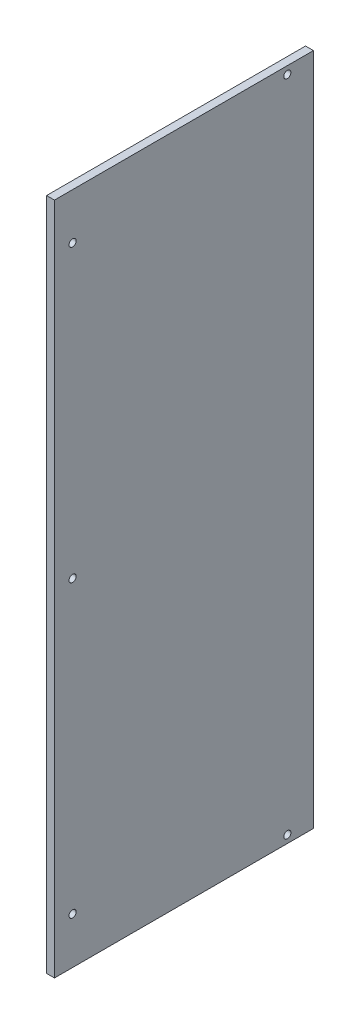
from build123d import *

# Parameters (mm, degrees)
SKETCH1_W             = 156.21
SKETCH1_H             = 406.4
BOSS_EXTRUDE1_DEPTH   = 4.7625
F_8_CLEARANCE_HOLE1_D = 4.3053


with BuildPart() as part:
    # Sketch1 → Boss-Extrude1 (new body)
    with BuildSketch(Plane(origin=(0, 0, 0), x_dir=(0, 0, -1), z_dir=(1, 0, 0))):
        with Locations((216.4528366, 22.964383562)):
            Rectangle(SKETCH1_W, SKETCH1_H)
    extrude(amount=BOSS_EXTRUDE1_DEPTH)

    # #8 Clearance Hole1 (through all)
    with Locations(Plane.ZY):
        with Locations((-149.2698366, 198.351383562), (-149.2698366, -152.168616438), (-149.2698366, 23.091383562), (-278.8098366, 221.528883562), (-278.8098366, -175.600116438)):
            Hole(F_8_CLEARANCE_HOLE1_D / 2)


solid = part.part
